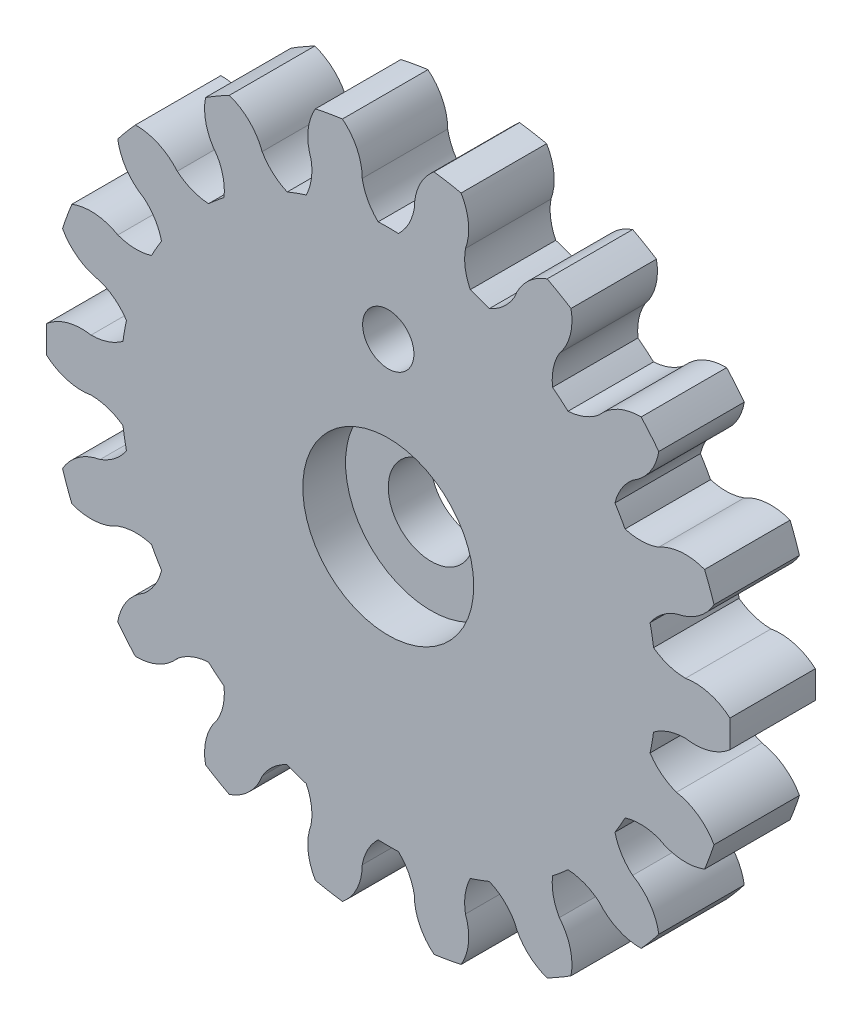
from build123d import *

# Parameters (mm, degrees)
CROQUIS1_R              = 20
CROQUIS1_R_2            = 2.5
CROQUIS1_R_3            = 1.5
SALIENTE_EXTRUIR1_DEPTH = 5
CORTAR_EXTRUIR1_DEPTH   = 29.722813233
MATRIZC1_COUNT          = 18
CROQUIS3_R              = 5
CORTAR_EXTRUIR2_DEPTH   = 2.5


with BuildPart() as part:
    # Croquis1 → Saliente-Extruir1 (new body)
    with BuildSketch(Plane.XY):
        Circle(CROQUIS1_R)
        Circle(CROQUIS1_R_2, mode=Mode.SUBTRACT)
        with Locations((0, 10)):
            Circle(CROQUIS1_R_3, mode=Mode.SUBTRACT)
    extrude(amount=SALIENTE_EXTRUIR1_DEPTH)

    # Croquis2 → Cortar-Extruir1 (cut, through all)
    with BuildSketch(Plane.XY.offset(5)):
        with BuildLine():
            ThreePointArc((2.678584333, 19.819818011), (0, 20), (-2.678584333, 19.819818011))
            ThreePointArc((-2.678584333, 19.819818011), (-1.82600889, 18.733131722), (-1.522223543, 17.385731841))
            ThreePointArc((-1.522223543, 17.385731841), (-1.19593308, 16.445057276), (-0.5915417, 15.653827117))
            ThreePointArc((-0.5915417, 15.653827117), (0, 15.665), (0.5915417, 15.653827117))
            ThreePointArc((0.5915417, 15.653827117), (1.19593308, 16.445057276), (1.522223543, 17.385731841))
            ThreePointArc((1.522223543, 17.385731841), (1.82600889, 18.733131722), (2.678584333, 19.819818011))
        make_face()
    cortar_extruir1 = extrude(amount=-CORTAR_EXTRUIR1_DEPTH, mode=Mode.SUBTRACT)

    # MatrizC1: Cortar-Extruir1 ×18 about axis
    matrizc1_axis = Axis((0, 0, 0), (0, 0, 1))
    for i in range(1, MATRIZC1_COUNT):
        add(cortar_extruir1.rotate(matrizc1_axis, i * 360 / MATRIZC1_COUNT), mode=Mode.SUBTRACT)

    # Croquis3 → Cortar-Extruir2 (cut)
    with BuildSketch(Plane.XY.offset(5)):
        Circle(CROQUIS3_R)
    extrude(amount=-CORTAR_EXTRUIR2_DEPTH, mode=Mode.SUBTRACT)


solid = part.part
